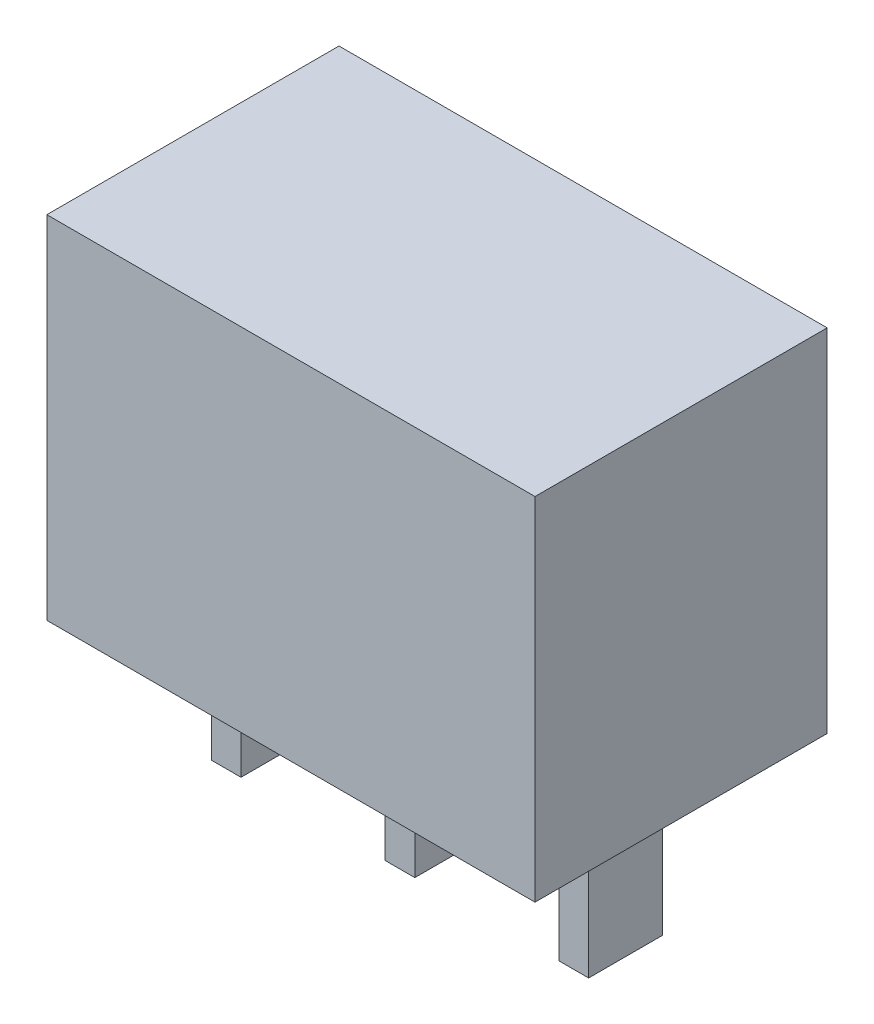
from build123d import *

# Parameters (mm, degrees)
SKETCH1_W           = 13.2
SKETCH1_H           = 7.9
BOSS_EXTRUDE1_DEPTH = 9.5
SKETCH2_W           = 0.8
SKETCH2_H           = 2
BOSS_EXTRUDE2_DEPTH = 4


with BuildPart() as part:
    # Sketch1 → Boss-Extrude1 (new body)
    with BuildSketch(Plane(origin=(0, 0, 0), x_dir=(1, 0, 0), z_dir=(0, 1, 0))):
        Rectangle(SKETCH1_W, SKETCH1_H)
    extrude(amount=BOSS_EXTRUDE1_DEPTH)

    # Sketch2 → Boss-Extrude2 (add)
    with BuildSketch(Plane.XZ):
        Rectangle(SKETCH2_W, SKETCH2_H)
        with Locations((4.7, 0)):
            Rectangle(SKETCH2_W, SKETCH2_H)
        with Locations((-4.7, 0)):
            Rectangle(SKETCH2_W, SKETCH2_H)
    extrude(amount=BOSS_EXTRUDE2_DEPTH)


solid = part.part
